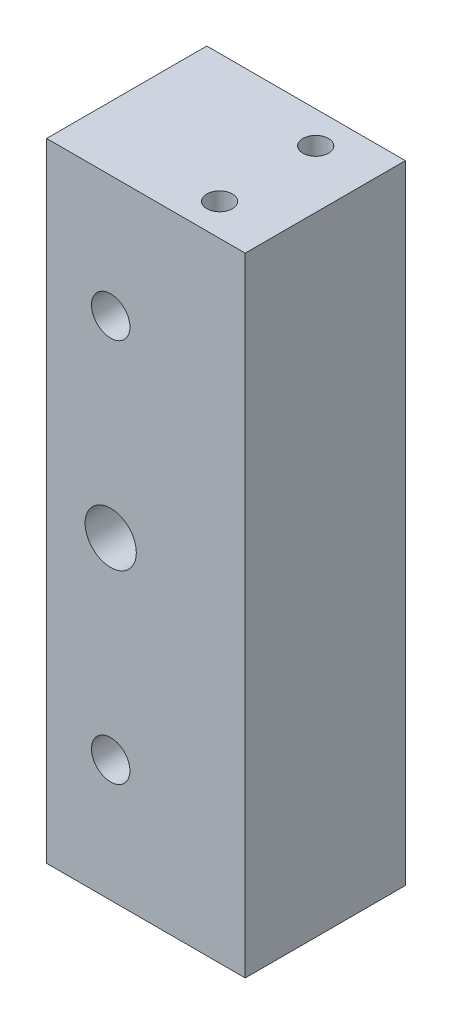
from build123d import *

# Parameters (mm, degrees)
SKETCH1_W           = 20
SKETCH1_H           = 98
SKETCH1_R           = 4
SKETCH1_R_2         = 3
BOSS_EXTRUDE1_DEPTH = 25
SKETCH2_W           = 11
SKETCH2_H           = 98
BOSS_EXTRUDE2_DEPTH = 25
SKETCH3_R           = 2
CUT_EXTRUDE1_DEPTH  = 25


with BuildPart() as part:
    # Sketch1 → Boss-Extrude1 (new body)
    with BuildSketch(Plane.XY):
        Rectangle(SKETCH1_W, SKETCH1_H)
        Circle(SKETCH1_R, mode=Mode.SUBTRACT)
        with Locations((0, -30)):
            Circle(SKETCH1_R_2, mode=Mode.SUBTRACT)
        with Locations((0, 30)):
            Circle(SKETCH1_R_2, mode=Mode.SUBTRACT)
    extrude(amount=BOSS_EXTRUDE1_DEPTH)

    # Sketch2 → Boss-Extrude2 (add, through all)
    with BuildSketch(Plane(origin=(0, 0, 0), x_dir=(-1, 0, 0), z_dir=(0, 0, -1))):
        with Locations((-15.5, 0)):
            Rectangle(SKETCH2_W, SKETCH2_H)
    extrude(amount=-BOSS_EXTRUDE2_DEPTH)

    # Sketch3 → Cut-Extrude1 (cut)
    with BuildSketch(Plane(origin=(0, 49, 0), x_dir=(1, 0, 0), z_dir=(0, 1, 0))):
        with Locations(Location((12, -5, 0), (0, 0, 270))):
            Circle(SKETCH3_R)
        with Locations(Location((12, -20, 0), (0, 0, 270))):
            Circle(SKETCH3_R)
    cut_extrude1 = extrude(amount=-CUT_EXTRUDE1_DEPTH, mode=Mode.SUBTRACT)

    # Mirror1: Cut-Extrude1 across plane
    add(cut_extrude1.mirror(Plane.ZX), mode=Mode.SUBTRACT)


solid = part.part
